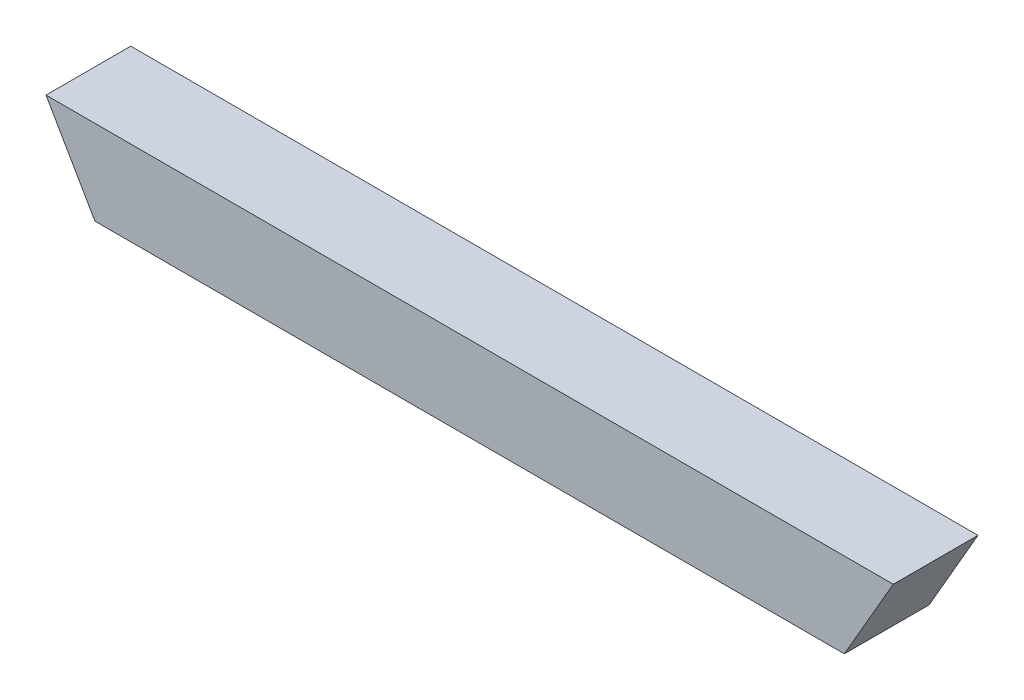
from build123d import *

# Parameters (mm, degrees)
BOSS_EXTRUDE1_DEPTH = 20


with BuildPart() as part:
    # Sketch1 → Boss-Extrude1 (new body)
    with BuildSketch(Plane.XY):
        Polygon((-100, 0), (100, 0), (88.452994616, -20), (-88.452994616, -20), align=None)
    extrude(amount=BOSS_EXTRUDE1_DEPTH)


solid = part.part
